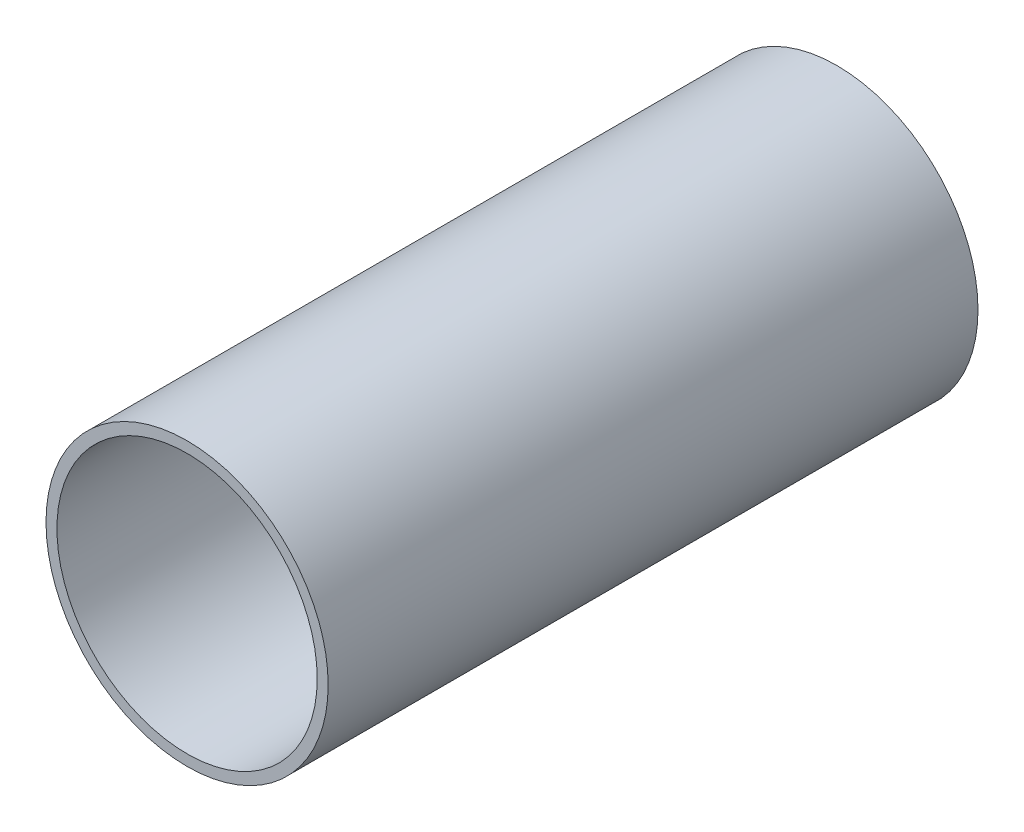
from build123d import *

# Parameters (mm, degrees)
EXTRUDE_START        = -60
EXTRUDE_SKETCH_1_R   = 80
EXTRUDE_SKETCH_1_R_2 = 73.8
EXTRUDE_1_DEPTH      = 368.5


with BuildPart() as part:
    # Extrude sketch 1 → Extrude 1 (new body)
    with BuildSketch(Plane.XY.offset(EXTRUDE_START)):
        with Locations((240, 0)):
            Circle(EXTRUDE_SKETCH_1_R)
        with Locations((240, 0)):
            Circle(EXTRUDE_SKETCH_1_R_2, mode=Mode.SUBTRACT)
    extrude(amount=EXTRUDE_1_DEPTH)


solid = part.part
